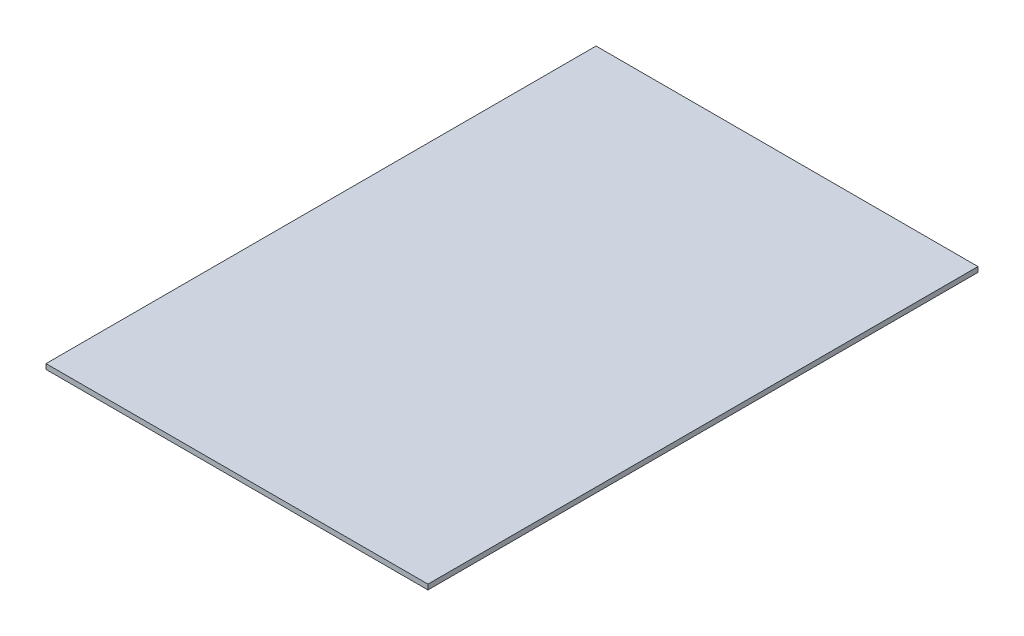
from build123d import *

# Parameters (mm, degrees)
SKETCH1_W           = 450.8
SKETCH1_H           = 649.2
BOSS_EXTRUDE1_DEPTH = 6


with BuildPart() as part:
    # Sketch1 → Boss-Extrude1 (new body)
    with BuildSketch(Plane(origin=(0, 0, 0), x_dir=(1, 0, 0), z_dir=(0, 1, 0))):
        Rectangle(SKETCH1_W, SKETCH1_H)
    extrude(amount=BOSS_EXTRUDE1_DEPTH)


solid = part.part
